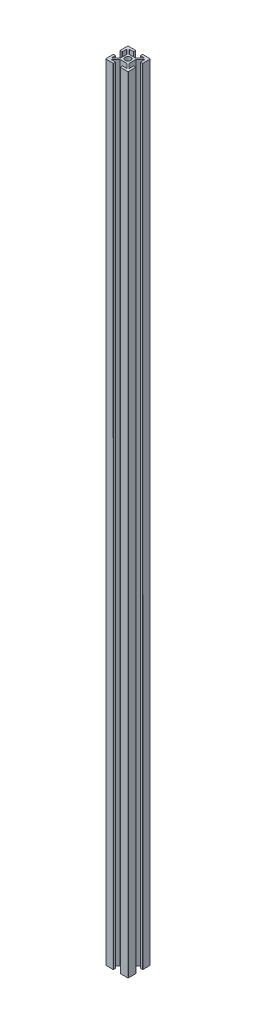
from build123d import *

# Parameters (mm, degrees)
SKETCH1_R           = 2.5
BOSS_EXTRUDE2_DEPTH = 700


with BuildPart() as part:
    # Sketch1 → Boss-Extrude2 (new body)
    with BuildSketch(Plane(origin=(0, 0, 0), x_dir=(1, 0, 0), z_dir=(0, 1, 0))):
        with BuildLine():
            Line((-9.896296296, 3), (-8.196296296, 3))
            ThreePointArc((-8.196296296, 3), (-8.090230279, 3.043933983), (-8.046296296, 3.15))
            Line((-8.046296296, 3.15), (-8.046296296, 6.586184513))
            ThreePointArc((-8.046296296, 6.586184513), (-7.954097251, 6.724600732), (-7.790842301, 6.692859041))
            Line((-7.790842301, 6.692859041), (-4, 2.945390222))
            Line((-4, 2.945390222), (-4, -2.945390222))
            Line((-4, -2.945390222), (-7.790842301, -6.692859041))
            ThreePointArc((-7.790842301, -6.692859041), (-7.954097251, -6.724600732), (-8.046296296, -6.586184513))
            Line((-8.046296296, -6.586184513), (-8.046296296, -3.15))
            ThreePointArc((-8.046296296, -3.15), (-8.090230279, -3.043933983), (-8.196296296, -3))
            Line((-8.196296296, -3), (-9.896296296, -3))
            ThreePointArc((-9.896296296, -3), (-10.002362313, -3.043933983), (-10.046296296, -3.15))
            Line((-10.046296296, -3.15), (-10.046296296, -9.65))
            ThreePointArc((-10.046296296, -9.65), (-9.94378367, -9.897487373), (-9.696296296, -10))
            Line((-9.696296296, -10), (-3.196296296, -10))
            ThreePointArc((-3.196296296, -10), (-3.090230279, -9.956066017), (-3.046296296, -9.85))
            Line((-3.046296296, -9.85), (-3.046296296, -8.15))
            ThreePointArc((-3.046296296, -8.15), (-3.090230279, -8.043933983), (-3.196296296, -8))
            Line((-3.196296296, -8), (-6.614381093, -8))
            ThreePointArc((-6.614381093, -8), (-6.753127587, -7.9070036), (-6.719835089, -7.743325472))
            Line((-6.719835089, -7.743325472), (-2.93318409, -4))
            Line((-2.93318409, -4), (2.93318409, -4))
            Line((2.93318409, -4), (6.719835089, -7.743325472))
            ThreePointArc((6.719835089, -7.743325472), (6.753127587, -7.9070036), (6.614381093, -8))
            Line((6.614381093, -8), (3.196296296, -8))
            ThreePointArc((3.196296296, -8), (3.090230279, -8.043933983), (3.046296296, -8.15))
            Line((3.046296296, -8.15), (3.046296296, -9.85))
            ThreePointArc((3.046296296, -9.85), (3.090230279, -9.956066017), (3.196296296, -10))
            Line((3.196296296, -10), (9.696296296, -10))
            ThreePointArc((9.696296296, -10), (9.94378367, -9.897487373), (10.046296296, -9.65))
            Line((10.046296296, -9.65), (10.046296296, -3.15))
            ThreePointArc((10.046296296, -3.15), (10.002362313, -3.043933983), (9.896296296, -3))
            Line((9.896296296, -3), (8.196296296, -3))
            ThreePointArc((8.196296296, -3), (8.090230279, -3.043933983), (8.046296296, -3.15))
            Line((8.046296296, -3.15), (8.046296296, -6.586184513))
            ThreePointArc((8.046296296, -6.586184513), (7.954097251, -6.724600732), (7.790842301, -6.692859041))
            Line((7.790842301, -6.692859041), (4, -2.945390222))
            Line((4, -2.945390222), (4, 2.945390222))
            Line((4, 2.945390222), (7.790842301, 6.692859041))
            ThreePointArc((7.790842301, 6.692859041), (7.954097251, 6.724600732), (8.046296296, 6.586184513))
            Line((8.046296296, 6.586184513), (8.046296296, 3.15))
            ThreePointArc((8.046296296, 3.15), (8.090230279, 3.043933983), (8.196296296, 3))
            Line((8.196296296, 3), (9.896296296, 3))
            ThreePointArc((9.896296296, 3), (10.002362313, 3.043933983), (10.046296296, 3.15))
            Line((10.046296296, 3.15), (10.046296296, 9.65))
            ThreePointArc((10.046296296, 9.65), (9.94378367, 9.897487373), (9.696296296, 10))
            Line((9.696296296, 10), (3.196296296, 10))
            ThreePointArc((3.196296296, 10), (3.090230279, 9.956066017), (3.046296296, 9.85))
            Line((3.046296296, 9.85), (3.046296296, 8.15))
            ThreePointArc((3.046296296, 8.15), (3.090230279, 8.043933983), (3.196296296, 8))
            Line((3.196296296, 8), (6.614381093, 8))
            ThreePointArc((6.614381093, 8), (6.753127587, 7.9070036), (6.719835089, 7.743325472))
            Line((6.719835089, 7.743325472), (2.93318409, 4))
            Line((2.93318409, 4), (-2.93318409, 4))
            Line((-2.93318409, 4), (-6.719835089, 7.743325472))
            ThreePointArc((-6.719835089, 7.743325472), (-6.753127587, 7.9070036), (-6.614381093, 8))
            Line((-6.614381093, 8), (-3.196296296, 8))
            ThreePointArc((-3.196296296, 8), (-3.090230279, 8.043933983), (-3.046296296, 8.15))
            Line((-3.046296296, 8.15), (-3.046296296, 9.85))
            ThreePointArc((-3.046296296, 9.85), (-3.090230279, 9.956066017), (-3.196296296, 10))
            Line((-3.196296296, 10), (-9.696296296, 10))
            ThreePointArc((-9.696296296, 10), (-9.94378367, 9.897487373), (-10.046296296, 9.65))
            Line((-10.046296296, 9.65), (-10.046296296, 3.15))
            ThreePointArc((-10.046296296, 3.15), (-10.002362313, 3.043933983), (-9.896296296, 3))
        make_face()
        with Locations(Location((0, 0, 0), (0, 0, 270))):
            Circle(SKETCH1_R, mode=Mode.SUBTRACT)
    extrude(amount=BOSS_EXTRUDE2_DEPTH)


solid = part.part
